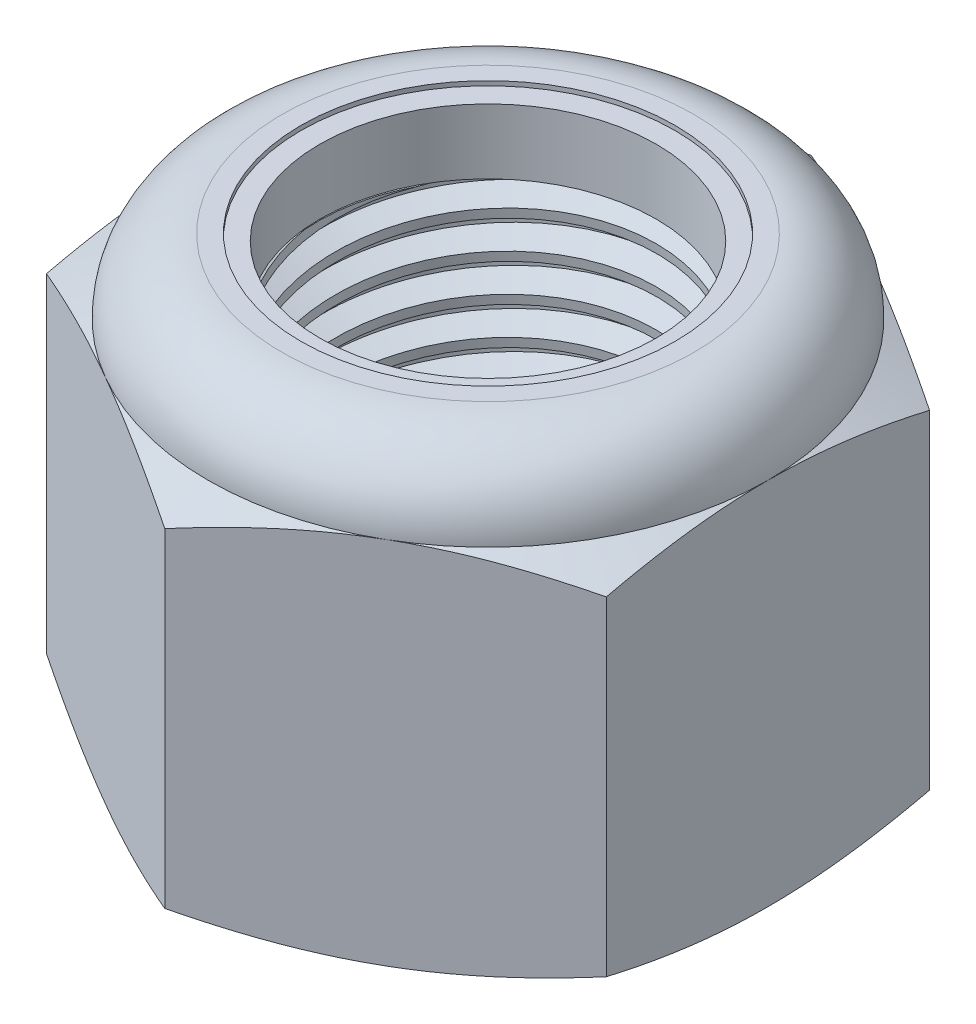
from build123d import *

# Parameters (mm, degrees)
EXTRUDE1_DEPTH      = 15.08125
SKETCH2_W           = 6.35
SKETCH2_H           = 15.08125
LPATTERN1_COUNT     = 12
LPATTERN1_PITCH     = 1.27
LPATTERN1_COL_COUNT = 2
LPATTERN1_COL_PITCH = 1.27


with BuildPart() as part:
    # Sketch1 → Extrude1 (new body)
    with BuildSketch(Plane(origin=(0, 0, 0), x_dir=(1, 0, 0), z_dir=(0, 1, 0))):
        Polygon((0, 10.998522628), (-9.525, 5.499261314), (-9.525, -5.499261314), (0, -10.998522628), (9.525, -5.499261314), (9.525, 5.499261314), align=None)
    extrude(amount=EXTRUDE1_DEPTH)

    # Sketch4 → Cut-Revolve2 (revolve, cut)
    with BuildSketch(Plane(origin=(0, 0, 0), x_dir=(0, 0, -1), z_dir=(1, 0, 0)), mode=Mode.PRIVATE) as cut_revolve2_sk:
        Polygon((0, 15.08125), (6.35, 15.08125), (5.721290563, 14.788077975), (5.721290563, 0.293172025), (6.35, 0), (0, 0), align=None)
    revolve(cut_revolve2_sk.sketch.rotate(Axis((0, 15.08125, 0), (0, 1, 0)), 54.6652943), axis=Axis((0, 15.08125, 0), (0, 1, 0)), mode=Mode.SUBTRACT)


with BuildPart() as body_2:
    # Sketch2 → Revolve1 (revolve)
    with BuildSketch(Plane(origin=(0, 0, 0), x_dir=(0, 0, -1), z_dir=(1, 0, 0))):
        with Locations((3.175, 7.540625)):
            Rectangle(SKETCH2_W, SKETCH2_H)
    revolve(axis=Axis((0, -6.35, 0), (0, 1, 0)))

    # Sketch3 → Cut-Revolve1 (revolve, cut)
    with BuildSketch(Plane(origin=(0, 0, 0), x_dir=(0, 0, -1), z_dir=(1, 0, 0)), mode=Mode.PRIVATE) as cut_revolve1_sk:
        Polygon((6.365796215, 14.923287846), (6.476369723, 13.817552768), (5.752882994, 14.144058534), (5.721290563, 14.459982842), align=None)
    cut_revolve1 = revolve(cut_revolve1_sk.sketch.rotate(Axis((0, 15.08125, 0.135293799), (0, -0.9950371902099892, -0.09950371902099908)), 180), axis=Axis((0, 15.08125, 0.135293799), (0, -0.9950371902099892, -0.09950371902099908)), mode=Mode.SUBTRACT)

    # LPattern1: Cut-Revolve1 ×12
    with Locations(*[(0, -i * LPATTERN1_PITCH, 0) for i in range(1, LPATTERN1_COUNT)]):
        add(cut_revolve1, mode=Mode.SUBTRACT)

    # LPattern1 col: Cut-Revolve1 ×2
    with Locations(*[(0, i * LPATTERN1_COL_PITCH, 0) for i in range(1, LPATTERN1_COL_COUNT)]):
        add(cut_revolve1, mode=Mode.SUBTRACT)


with BuildPart() as part_1:
    add(part.part)

    # Combine1: cut body 2
    add(body_2.part, mode=Mode.SUBTRACT)

    # Sketch5 → Cut-Revolve3 (revolve, cut)
    with BuildSketch(Plane(origin=(0, 0, 0), x_dir=(0, 0, -1), z_dir=(1, 0, 0)), mode=Mode.PRIVATE) as cut_revolve3_sk:
        with BuildLine():
            Line((0, 0), (9.525, 0))
            Line((9.525, 0), (10.998522628, 0.687114886))
            Line((10.998522628, 0.687114886), (10.998522628, 11.880593447))
            Line((10.998522628, 11.880593447), (9.525, 12.567708333))
            ThreePointArc((9.525, 12.567708333), (8.788800691, 14.345050691), (7.011458333, 15.08125))
            Line((7.011458333, 15.08125), (7.011458333, 16.35125))
            Line((7.011458333, 16.35125), (12.268522628, 16.35125))
            Line((12.268522628, 16.35125), (12.268522628, -1.27))
            Line((12.268522628, -1.27), (0, -1.27))
            Line((0, -1.27), (0, 0))
        make_face()
    revolve(cut_revolve3_sk.sketch.rotate(Axis((0, 0, 0), (0, 1, 0)), 54.6652943), axis=Axis((0, 0, 0), (0, 1, 0)), mode=Mode.SUBTRACT)

    # Sketch6 → Cut-Revolve4 (revolve, cut)
    with BuildSketch(Plane(origin=(0, 0, 0), x_dir=(0, 0, -1), z_dir=(1, 0, 0)), mode=Mode.PRIVATE) as cut_revolve4_sk:
        with BuildLine():
            Line((0, 12.567708333), (9.3726, 12.567708333))
            ThreePointArc((9.3726, 12.567708333), (8.681037617, 14.237287617), (7.011458333, 14.92885))
            Line((7.011458333, 14.92885), (6.366374448, 14.92885))
            Line((6.366374448, 14.92885), (6.366374448, 16.35125))
            Line((6.366374448, 16.35125), (0, 16.35125))
            Line((0, 16.35125), (0, 12.567708333))
        make_face()
    revolve(cut_revolve4_sk.sketch.rotate(Axis((0, 16.35125, 0), (0, 1, 0)), 54.6652943), axis=Axis((0, 16.35125, 0), (0, 1, 0)), mode=Mode.SUBTRACT)


with BuildPart() as body_2_2:
    # Sketch7 → Revolve2 (revolve)
    with BuildSketch(Plane(origin=(0, 0, 0), x_dir=(0, 0, -1), z_dir=(1, 0, 0)), mode=Mode.PRIVATE) as revolve2_sk:
        with BuildLine():
            Line((5.721290563, 12.643908333), (9.295129058, 12.643908333))
            ThreePointArc((9.295129058, 12.643908333), (8.599986877, 14.210125907), (7.011458333, 14.85265))
            Line((7.011458333, 14.85265), (5.721290563, 14.85265))
            Line((5.721290563, 14.85265), (5.721290563, 12.643908333))
        make_face()
    revolve(revolve2_sk.sketch.rotate(Axis((0, 12.643908333, 0), (0, 1, 0)), 54.6652943), axis=Axis((0, 12.643908333, 0), (0, 1, 0)))


solid = Compound([part_1.part, body_2_2.part])
